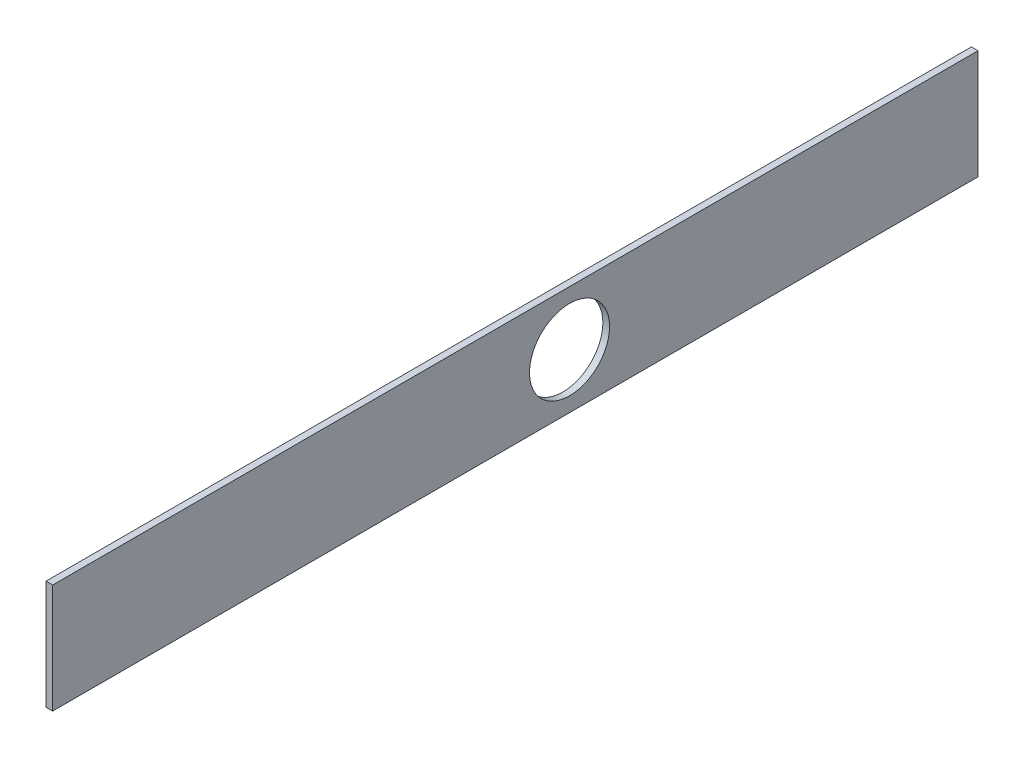
from build123d import *

# Parameters (mm, degrees)
SKETCH_1_W      = 1110
SKETCH_1_H      = 131
SKETCH_1_R      = 48
EXTRUDE_1_DEPTH = 8


with BuildPart() as part:
    # 草图1 → 凸台-拉伸1 (new body)
    with BuildSketch(Plane(origin=(0, 0, 0), x_dir=(0, 0, -1), z_dir=(1, 0, 0))):
        with Locations((-65, 0)):
            Rectangle(SKETCH_1_W, SKETCH_1_H)
        Circle(SKETCH_1_R, mode=Mode.SUBTRACT)
    extrude(amount=EXTRUDE_1_DEPTH)


solid = part.part
